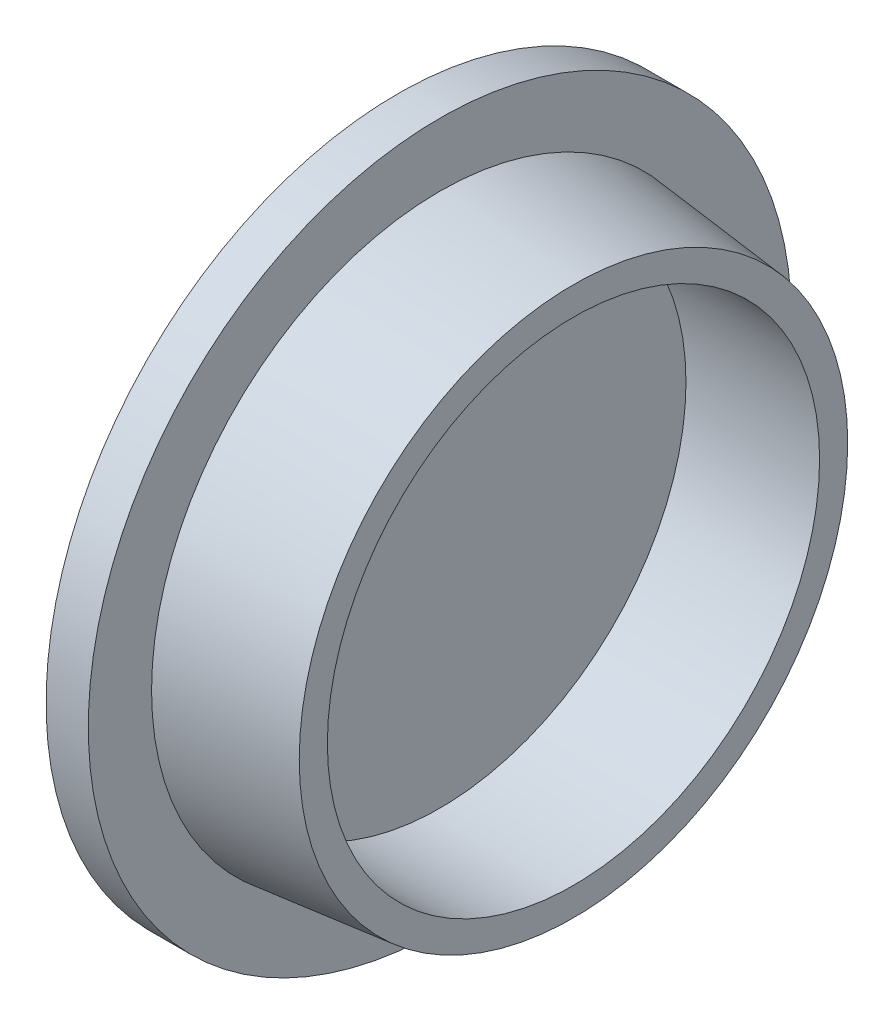
from build123d import *


with BuildPart() as part:
    # 草图1 → 旋转1 (revolve)
    with BuildSketch(Plane.XY, mode=Mode.PRIVATE) as revolve_1_sk:
        Polygon((-1.9, 0), (-2.5, 0), (-2.5, 3.5), (-2.5, 5), (-1.9, 5), (-1.9, 4.1), (0, 3.9), (0, 3.5), (-1.9, 3.5), align=None)
    revolve(revolve_1_sk.sketch.rotate(Axis((-1.9, 0, 0), (-1, 0, 0)), 90), axis=Axis((-1.9, 0, 0), (-1, 0, 0)))


solid = part.part
